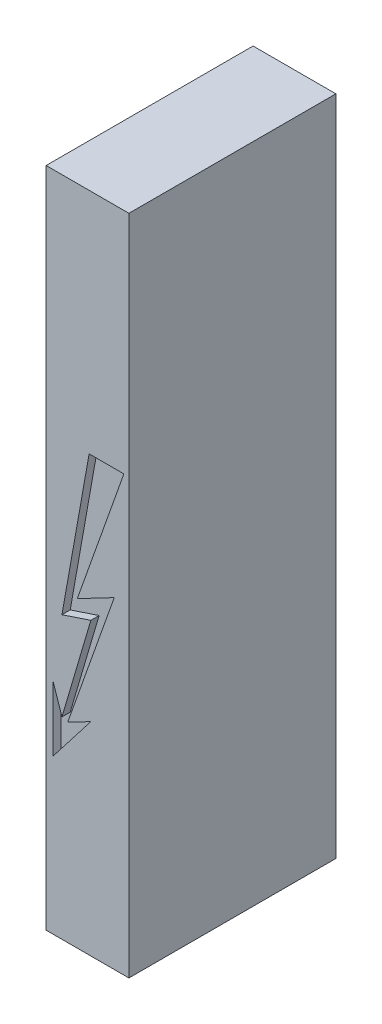
from build123d import *

# Parameters (mm, degrees)
SKETCH1_W           = 10
SKETCH1_H           = 80
BOSS_EXTRUDE1_DEPTH = 12.5
CUT_EXTRUDE1_DEPTH  = 1


with BuildPart() as part:
    # Sketch1 → Boss-Extrude1 (new, symmetric)
    with BuildSketch(Plane.XY):
        Rectangle(SKETCH1_W, SKETCH1_H)
    extrude(amount=BOSS_EXTRUDE1_DEPTH, both=True)

    # Sketch2 → Cut-Extrude1 (cut)
    with BuildSketch(Plane.XY.offset(12.5)):
        Polygon((0.193183959, 12.431010412), (-3.090931772, -6.042140576), (0.403107323, -4.877460877), (-3.090931772, -16.736017806), (-4.194169453, -13.426304764), (-4.194169453, -21.412180594), (0.403107323, -15.476046132), (-2.395490823, -16.940924514), (3.226945299, -1.094134401), (-1.238032252, -3.43125061), (4.389892943, 12.431010412), align=None)
    extrude(amount=-CUT_EXTRUDE1_DEPTH, mode=Mode.SUBTRACT)


solid = part.part
